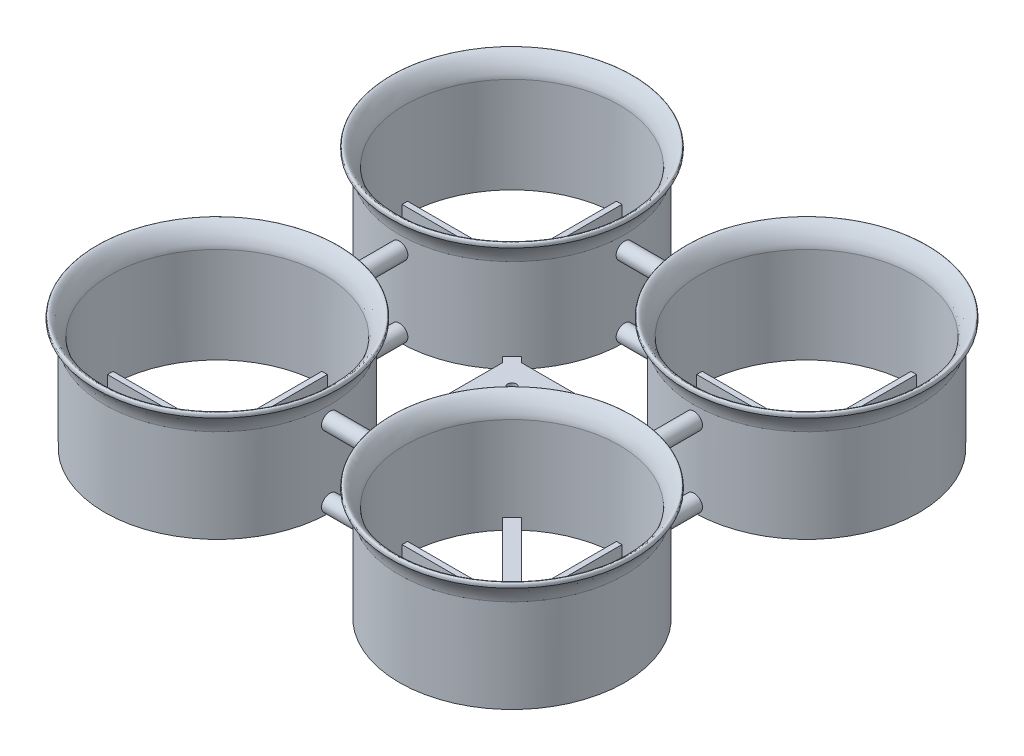
from build123d import *

# Parameters (mm, degrees)
SKETCH1_R           = 41.1
SKETCH1_R_2         = 1.05
SKETCH1_R_3         = 2.5
BOSS_EXTRUDE3_DEPTH = 4
CIRPATTERN1_COUNT   = 4
BOSS_EXTRUDE6_START = -12.749751
SKETCH8_R           = 3
BOSS_EXTRUDE6_DEPTH = 25.499502
SKETCH9_R           = 1.6
BOSS_EXTRUDE7_DEPTH = 4
BOSS_EXTRUDE8_START = -12.749751
SKETCH10_R          = 3
BOSS_EXTRUDE8_DEPTH = 25.499502


with BuildPart() as part:
    # Sketch1 → Boss-Extrude3 (new body)
    with BuildSketch(Plane(origin=(0, 0, 0), x_dir=(1, 0, 0), z_dir=(0, 1, 0))):
        with Locations(Location((-53.74011537, 53.74011537, 0), (0, 0, 270))):
            Circle(SKETCH1_R)
        with Locations(Location((-56.922095886, 56.922095886, 0), (0, 0, 270))):
            Circle(SKETCH1_R_2, mode=Mode.SUBTRACT)
        with Locations(Location((-50.558134855, 56.922095886, 0), (0, 0, 270))):
            Circle(SKETCH1_R_2, mode=Mode.SUBTRACT)
        with Locations(Location((-50.558134855, 50.558134855, 0), (0, 0, 270))):
            Circle(SKETCH1_R_2, mode=Mode.SUBTRACT)
        with Locations(Location((-56.922095886, 50.558134855, 0), (0, 0, 270))):
            Circle(SKETCH1_R_2, mode=Mode.SUBTRACT)
        with Locations(Location((-53.74011537, 53.74011537, 0), (0, 0, 270))):
            Circle(SKETCH1_R_3, mode=Mode.SUBTRACT)
        with BuildLine():
            Line((-52.74011537, 46.81191214), (-52.74011537, 14.652905186))
            ThreePointArc((-52.74011537, 14.652905186), (-26.092240226, 26.092240226), (-14.652905186, 52.74011537))
            Line((-14.652905186, 52.74011537), (-46.81191214, 52.74011537))
            ThreePointArc((-46.81191214, 52.74011537), (-48.790367902, 48.790367902), (-52.74011537, 46.81191214))
        make_face(mode=Mode.SUBTRACT)
        with BuildLine():
            Line((-54.74011537, 46.81191214), (-54.74011537, 14.652905186))
            ThreePointArc((-54.74011537, 14.652905186), (-81.387990515, 26.092240226), (-92.827325555, 52.74011537))
            Line((-92.827325555, 52.74011537), (-60.6683186, 52.74011537))
            ThreePointArc((-60.6683186, 52.74011537), (-58.689862838, 48.790367902), (-54.74011537, 46.81191214))
        make_face(mode=Mode.SUBTRACT)
        with BuildLine():
            Line((-60.6683186, 54.74011537), (-92.827325555, 54.74011537))
            ThreePointArc((-92.827325555, 54.74011537), (-81.387990515, 81.387990515), (-54.74011537, 92.827325555))
            Line((-54.74011537, 92.827325555), (-54.74011537, 60.6683186))
            ThreePointArc((-54.74011537, 60.6683186), (-58.689862838, 58.689862838), (-60.6683186, 54.74011537))
        make_face(mode=Mode.SUBTRACT)
        with BuildLine():
            Line((-52.74011537, 60.6683186), (-52.74011537, 92.827325555))
            ThreePointArc((-52.74011537, 92.827325555), (-26.092240226, 81.387990515), (-14.652905186, 54.74011537))
            Line((-14.652905186, 54.74011537), (-46.81191214, 54.74011537))
            ThreePointArc((-46.81191214, 54.74011537), (-48.790367902, 58.689862838), (-52.74011537, 60.6683186))
        make_face(mode=Mode.SUBTRACT)
    extrude(amount=BOSS_EXTRUDE3_DEPTH)

    # Sketch6 → Revolve1 (revolve)
    with BuildSketch(Plane.XY.offset(-53.74011537), mode=Mode.PRIVATE) as revolve1_sk:
        with BuildLine():
            Line((-94.84011537, 4), (-94.84011537, 34))
            add(Edge.make_bspline(
                [(-94.84011537, 34), (-95.399515906, 37.721264963), (-97.94011537, 40.5)],
                knots=[0, 0, 0, 1, 1, 1], degree=2))
            add(Edge.make_bspline(
                [(-97.94011537, 40.5), (-98.333025109, 44.853557219), (-92.983420657, 38.417646613), (-92.84011537, 34.925)],
                knots=[0, 0, 0, 0, 1, 1, 1, 1], degree=3))
            Line((-92.84011537, 34.925), (-92.84011537, 4))
            Line((-92.84011537, 4), (-94.84011537, 4))
        make_face()
    revolve(revolve1_sk.sketch.rotate(Axis((-53.74011537, 40.476401562, -53.74011537), (0, -1, 0)), 270), axis=Axis((-53.74011537, 40.476401562, -53.74011537), (0, -1, 0)))


with BuildPart() as cirpattern1_1:
    # CirPattern1: pattern copy
    add(part.part.rotate(Axis((0, 27.744144357, 0), (0, -1, 0)), 1 * 360 / CIRPATTERN1_COUNT))


with BuildPart() as cirpattern1_2:
    # CirPattern1: pattern copy
    add(part.part.rotate(Axis((0, 27.744144357, 0), (0, -1, 0)), 2 * 360 / CIRPATTERN1_COUNT))


with BuildPart() as cirpattern1_3:
    # CirPattern1: pattern copy
    add(part.part.rotate(Axis((0, 27.744144357, 0), (0, -1, 0)), 3 * 360 / CIRPATTERN1_COUNT))


with BuildPart() as part_1:
    add(part.part)

    add(cirpattern1_1.part)  # Boss-Extrude6 merges CirPattern1_1

    add(cirpattern1_2.part)  # Boss-Extrude6 merges CirPattern1_2

    add(cirpattern1_3.part)  # Boss-Extrude6 merges CirPattern1_3
    # Sketch8 → Boss-Extrude6 (add)
    with BuildSketch(Plane.XY.offset(BOSS_EXTRUDE6_START)):
        with Locations((-53.74011537, 3.096205832)):
            Circle(SKETCH8_R)
        with Locations((-53.74011537, 29)):
            Circle(SKETCH8_R)
        with Locations((53.74011537, 3.096205832)):
            Circle(SKETCH8_R)
        with Locations((53.74011537, 29)):
            Circle(SKETCH8_R)
    extrude(amount=BOSS_EXTRUDE6_DEPTH)

    # Sketch9 → Boss-Extrude7 (add)
    with BuildSketch(Plane(origin=(0, 0, 0), x_dir=(1, 0, 0), z_dir=(0, 1, 0))):
        Polygon((-50.884571821, -47.349037915), (-24.5, -20.964466094), (-24.5, 20.964466094), (-50.884571821, 47.349037915), (-47.349037915, 50.884571821), (-20.964466094, 24.5), (20.964466094, 24.5), (47.349037915, 50.884571821), (50.884571821, 47.349037915), (24.5, 20.964466094), (24.5, -20.964466094), (50.884571821, -47.349037915), (47.349037915, -50.884571821), (20.964466094, -24.5), (-20.964466094, -24.5), (-47.349037915, -50.884571821), align=None)
        with Locations(Location((-15.25, 15.25, 0), (0, 0, 270))):
            Circle(SKETCH9_R, mode=Mode.SUBTRACT)
        with Locations(Location((15.25, 15.25, 0), (0, 0, 270))):
            Circle(SKETCH9_R, mode=Mode.SUBTRACT)
        with Locations(Location((15.25, -15.25, 0), (0, 0, 270))):
            Circle(SKETCH9_R, mode=Mode.SUBTRACT)
        with Locations(Location((-15.25, -15.25, 0), (0, 0, 270))):
            Circle(SKETCH9_R, mode=Mode.SUBTRACT)
    extrude(amount=BOSS_EXTRUDE7_DEPTH)

    # Sketch10 → Boss-Extrude8 (add)
    with BuildSketch(Plane(origin=(0, 0, 0), x_dir=(0, 0, -1), z_dir=(1, 0, 0)).offset(BOSS_EXTRUDE8_START)):
        with Locations(Location((-53.74011537, 3.096205832, 0), (0, 0, 180))):
            Circle(SKETCH10_R)
        with Locations(Location((-53.74011537, 29, 0), (0, 0, 180))):
            Circle(SKETCH10_R)
        with Locations(Location((53.74011537, 3.096205832, 0), (0, 0, 180))):
            Circle(SKETCH10_R)
        with Locations(Location((53.74011537, 29, 0), (0, 0, 180))):
            Circle(SKETCH10_R)
    extrude(amount=BOSS_EXTRUDE8_DEPTH)


solid = part_1.part
